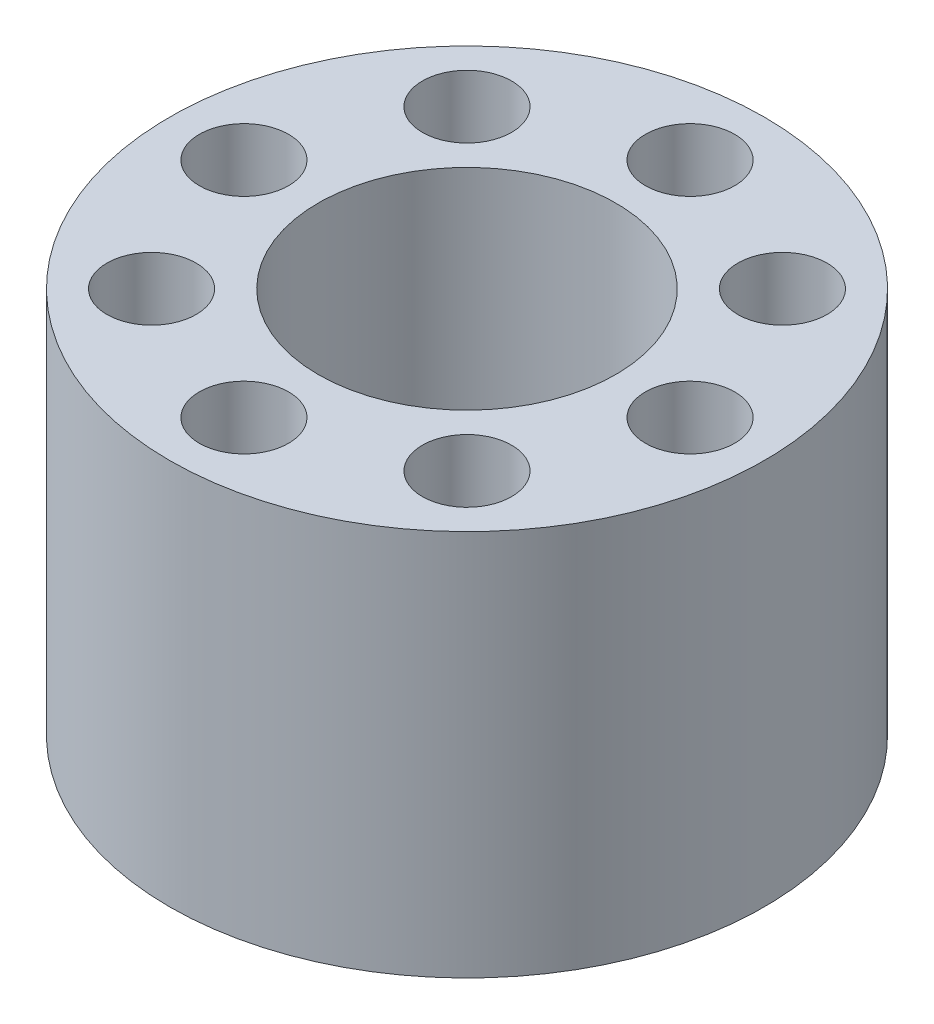
from build123d import *

# Parameters (mm, degrees)
SKETCH_2_W          = 5
SKETCH_2_H          = 13
SKETCH_3_R          = 1.5
CUT_EXTRUDE_1_DEPTH = 20.209372712


with BuildPart() as part:
    # 草图2 → 旋转1 (revolve)
    with BuildSketch(Plane.XY, mode=Mode.PRIVATE) as revolve_1_sk:
        with Locations((7.5, 6.5)):
            Rectangle(SKETCH_2_W, SKETCH_2_H)
    revolve(revolve_1_sk.sketch.rotate(Axis((0, 11.632555895, 0), (0, -1, 0)), 90), axis=Axis((0, 11.632555895, 0), (0, -1, 0)))

    # 草图3 → 切除-拉伸1 (cut, through all)
    with BuildSketch(Plane(origin=(0, 13, 0), x_dir=(1, 0, 0), z_dir=(0, 1, 0))):
        with Locations(Location((0, 7.5, 0), (0, 0, 270))):
            Circle(SKETCH_3_R)
        with Locations(Location((5.303300859, 5.303300859, 0), (0, 0, 270))):
            Circle(SKETCH_3_R)
        with Locations(Location((7.5, 0, 0), (0, 0, 270))):
            Circle(SKETCH_3_R)
        with Locations(Location((5.303300859, -5.303300859, 0), (0, 0, 270))):
            Circle(SKETCH_3_R)
        with Locations(Location((0, -7.5, 0), (0, 0, 270))):
            Circle(SKETCH_3_R)
        with Locations(Location((-5.303300859, -5.303300859, 0), (0, 0, 270))):
            Circle(SKETCH_3_R)
        with Locations(Location((-7.5, 0, 0), (0, 0, 270))):
            Circle(SKETCH_3_R)
        with Locations(Location((-5.303300859, 5.303300859, 0), (0, 0, 270))):
            Circle(SKETCH_3_R)
    extrude(amount=-CUT_EXTRUDE_1_DEPTH, mode=Mode.SUBTRACT)


solid = part.part
